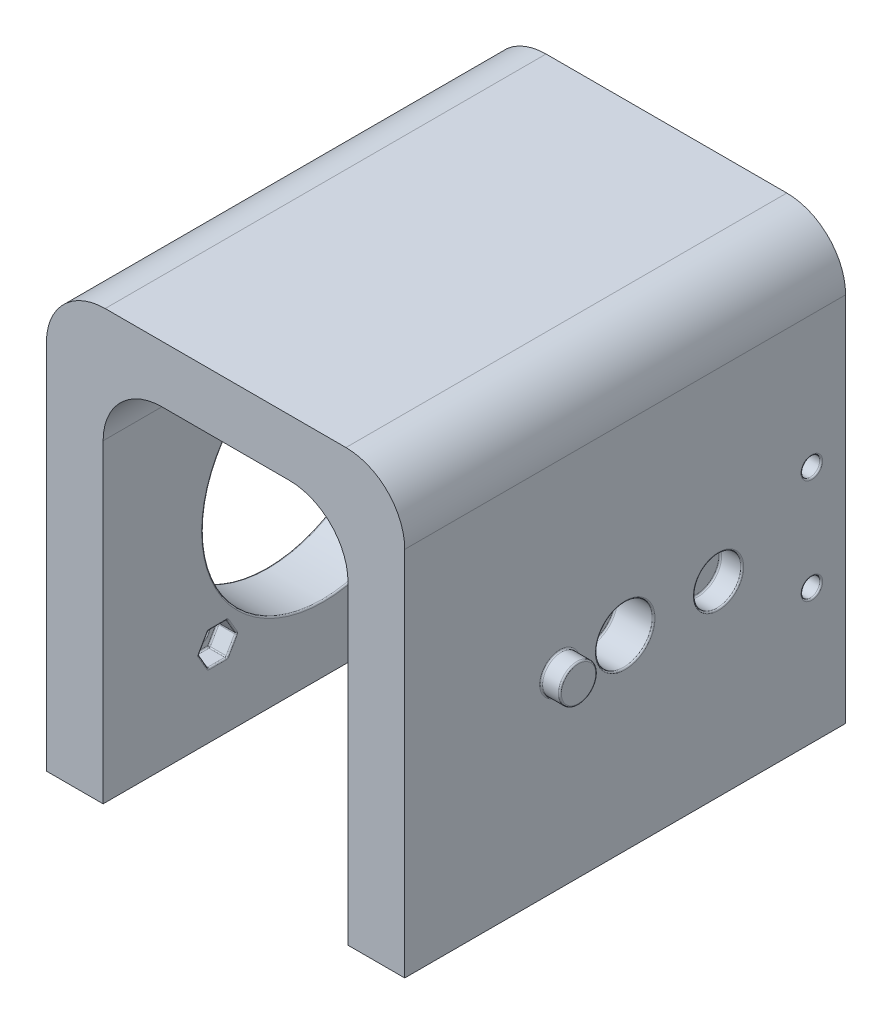
from build123d import *

# Parameters (mm, degrees)
BOSS_EXTRUDE1_DEPTH = 75
CUT_EXTRUDE1_REACH  = 123.212
SKETCH2_R           = 20.500000021
CUT_EXTRUDE2_REACH  = 123.212
SKETCH3_R           = 1.5875
CUT_EXTRUDE3_REACH  = 118.656
SKETCH4_R           = 3.429
BOSS_EXTRUDE2_START = 1.5875
SKETCH5_R           = 4.7625
SKETCH5_R_2         = 3.429
BOSS_EXTRUDE2_DEPTH = 1.5875
CUT_EXTRUDE5_REACH  = 123.212
SKETCH6_R           = 1.5875
SKETCH7_R           = 4.03225
CUT_EXTRUDE6_DEPTH  = 3.75
SKETCH8_R           = 4.826
CUT_EXTRUDE7_DEPTH  = 6.35
SKETCH9_R           = 3.175
BOSS_EXTRUDE3_DEPTH = 3.175
CUT_EXTRUDE8_DEPTH  = 3.175
BOSS_EXTRUDE4_START = 4.8
SKETCH11_R          = 2.55
SKETCH11_R_2        = 1.5875
BOSS_EXTRUDE4_DEPTH = 4.8
CUT_EXTRUDE9_DEPTH  = 3.175
FILLET1_R           = 10
FILLET2_R           = 0.25
FILLET3_R           = 0.25


with BuildPart() as part:
    # Sketch1 → Boss-Extrude1 (new body)
    with BuildSketch(Plane.XY):
        Polygon((-20.828, 63.5), (20.828, 63.5), (20.828, 0), (30.48, 0), (30.48, 73.152), (-30.48, 73.152), (-30.48, 0), (-20.828, 0), align=None)
    extrude(amount=BOSS_EXTRUDE1_DEPTH)

    # Sketch2 → Cut-Extrude1 (cut, up to next)
    with BuildSketch(Plane.ZY.offset(30.48), mode=Mode.PRIVATE) as cut_extrude1_sk1:
        with Locations(Location((37.5, 31.75, 0), (0, 0, 270))):
            Circle(SKETCH2_R)
    cut_extrude1_tool1 = extrude(cut_extrude1_sk1.sketch, amount=-CUT_EXTRUDE1_REACH, mode=Mode.PRIVATE) & part.part
    add(cut_extrude1_tool1.solids().sort_by_distance((-30.48, 31.75, 37.5))[0], mode=Mode.SUBTRACT)

    # Sketch3 → Cut-Extrude2 (cut, up to next)
    with BuildSketch(Plane.ZY.offset(30.48), mode=Mode.PRIVATE) as cut_extrude2_sk1:
        with Locations(Location((19.5, 49.75, 0), (0, 0, 270))):
            Circle(SKETCH3_R)
    cut_extrude2_tool1 = extrude(cut_extrude2_sk1.sketch, amount=-CUT_EXTRUDE2_REACH, mode=Mode.PRIVATE) & part.part
    # Sketch3 → Cut-Extrude2 (cut, up to next)
    with BuildSketch(Plane.ZY.offset(30.48), mode=Mode.PRIVATE) as cut_extrude2_sk2:
        with Locations(Location((55.5, 49.75, 0), (0, 0, 270))):
            Circle(SKETCH3_R)
    cut_extrude2_tool2 = extrude(cut_extrude2_sk2.sketch, amount=-CUT_EXTRUDE2_REACH, mode=Mode.PRIVATE) & part.part
    # Sketch3 → Cut-Extrude2 (cut, up to next)
    with BuildSketch(Plane.ZY.offset(30.48), mode=Mode.PRIVATE) as cut_extrude2_sk3:
        with Locations(Location((55.5, 13.75, 0), (0, 0, 270))):
            Circle(SKETCH3_R)
    cut_extrude2_tool3 = extrude(cut_extrude2_sk3.sketch, amount=-CUT_EXTRUDE2_REACH, mode=Mode.PRIVATE) & part.part
    # Sketch3 → Cut-Extrude2 (cut, up to next)
    with BuildSketch(Plane.ZY.offset(30.48), mode=Mode.PRIVATE) as cut_extrude2_sk4:
        with Locations(Location((19.5, 13.75, 0), (0, 0, 270))):
            Circle(SKETCH3_R)
    cut_extrude2_tool4 = extrude(cut_extrude2_sk4.sketch, amount=-CUT_EXTRUDE2_REACH, mode=Mode.PRIVATE) & part.part
    add(cut_extrude2_tool1.solids().sort_by_distance((-30.48, 49.75, 19.5))[0], mode=Mode.SUBTRACT)
    add(cut_extrude2_tool2.solids().sort_by_distance((-30.48, 49.75, 55.5))[0], mode=Mode.SUBTRACT)
    add(cut_extrude2_tool3.solids().sort_by_distance((-30.48, 13.75, 55.5))[0], mode=Mode.SUBTRACT)
    add(cut_extrude2_tool4.solids().sort_by_distance((-30.48, 13.75, 19.5))[0], mode=Mode.SUBTRACT)

    # Sketch4 → Cut-Extrude3 (cut, up to next)
    with BuildSketch(Plane.ZY.offset(-20.828), mode=Mode.PRIVATE) as cut_extrude3_sk1:
        with Locations((37.5, 31.75)):
            Circle(SKETCH4_R)
    cut_extrude3_tool1 = extrude(cut_extrude3_sk1.sketch, amount=-CUT_EXTRUDE3_REACH, mode=Mode.PRIVATE) & part.part
    add(cut_extrude3_tool1.solids().sort_by_distance((20.828, 31.75, 37.5))[0], mode=Mode.SUBTRACT)

    # Sketch5 → Boss-Extrude2 (add)
    with BuildSketch(Plane.ZY.offset(-20.828).offset(BOSS_EXTRUDE2_START)):
        with Locations(Location((37.5, 31.75, 0), (0, 0, 180))):
            Circle(SKETCH5_R)
        with Locations((37.5, 31.75)):
            Circle(SKETCH5_R_2, mode=Mode.SUBTRACT)
    extrude(amount=-BOSS_EXTRUDE2_DEPTH)

    # Sketch6 → Cut-Extrude5 (cut, up to next)
    with BuildSketch(Plane(origin=(30.48, 0, 0), x_dir=(0, 0, -1), z_dir=(1, 0, 0)), mode=Mode.PRIVATE) as cut_extrude5_sk1:
        with Locations(Location((-5.75, 40.64, 0), (0, 0, 90))):
            Circle(SKETCH6_R)
    cut_extrude5_tool1 = extrude(cut_extrude5_sk1.sketch, amount=-CUT_EXTRUDE5_REACH, mode=Mode.PRIVATE) & part.part
    # Sketch6 → Cut-Extrude5 (cut, up to next)
    with BuildSketch(Plane(origin=(30.48, 0, 0), x_dir=(0, 0, -1), z_dir=(1, 0, 0)), mode=Mode.PRIVATE) as cut_extrude5_sk2:
        with Locations(Location((-5.75, 22.86, 0), (0, 0, 90))):
            Circle(SKETCH6_R)
    cut_extrude5_tool2 = extrude(cut_extrude5_sk2.sketch, amount=-CUT_EXTRUDE5_REACH, mode=Mode.PRIVATE) & part.part
    add(cut_extrude5_tool1.solids().sort_by_distance((30.48, 40.64, 5.75))[0], mode=Mode.SUBTRACT)
    add(cut_extrude5_tool2.solids().sort_by_distance((30.48, 22.86, 5.75))[0], mode=Mode.SUBTRACT)

    # Sketch7 → Cut-Extrude6 (cut)
    with BuildSketch(Plane(origin=(30.48, 0, 0), x_dir=(0, 0, -1), z_dir=(1, 0, 0))):
        with Locations(Location((-21.625, 31.75, 0), (0, 0, 90))):
            Circle(SKETCH7_R)
    extrude(amount=-CUT_EXTRUDE6_DEPTH, mode=Mode.SUBTRACT)

    # Sketch8 → Cut-Extrude7 (cut)
    with BuildSketch(Plane(origin=(30.48, 0, 0), x_dir=(0, 0, -1), z_dir=(1, 0, 0))):
        with Locations(Location((-37.5, 31.75, 0), (0, 0, 90))):
            Circle(SKETCH8_R)
    extrude(amount=-CUT_EXTRUDE7_DEPTH, mode=Mode.SUBTRACT)

    # Sketch9 → Boss-Extrude3 (add)
    with BuildSketch(Plane(origin=(30.48, 0, 0), x_dir=(0, 0, -1), z_dir=(1, 0, 0))):
        with Locations(Location((-48.6125, 31.75, 0), (0, 0, 270))):
            Circle(SKETCH9_R)
    extrude(amount=BOSS_EXTRUDE3_DEPTH)

    # Sketch10 → Cut-Extrude8 (cut)
    with BuildSketch(Plane.ZY.offset(-20.828)):
        Polygon((8.925, 40.64), (7.3375, 43.389630657), (4.1625, 43.389630657), (2.575, 40.64), (4.1625, 37.890369343), (7.3375, 37.890369343), align=None)
        Polygon((8.925, 22.86), (7.3375, 25.609630657), (4.1625, 25.609630657), (2.575, 22.86), (4.1625, 20.110369343), (7.3375, 20.110369343), align=None)
    extrude(amount=-CUT_EXTRUDE8_DEPTH, mode=Mode.SUBTRACT)

    # Sketch11 → Boss-Extrude4 (add)
    # profile 1 of 4: a face of its own
    with BuildSketch(Plane.ZY.offset(30.48).offset(BOSS_EXTRUDE4_START)):
        with Locations(Location((19.5, 49.75, 0), (0, 0, 90))):
            Circle(SKETCH11_R)
        with Locations(Location((19.5, 49.75, 0), (0, 0, 270))):
            Circle(SKETCH11_R_2, mode=Mode.SUBTRACT)
    # profile 2 of 4: a face of its own
    with BuildSketch(Plane.ZY.offset(30.48).offset(BOSS_EXTRUDE4_START)):
        with Locations(Location((55.5, 49.75, 0), (0, 0, 90))):
            Circle(SKETCH11_R)
        with Locations(Location((55.5, 49.75, 0), (0, 0, 270))):
            Circle(SKETCH11_R_2, mode=Mode.SUBTRACT)
    # profile 3 of 4: a face of its own
    with BuildSketch(Plane.ZY.offset(30.48).offset(BOSS_EXTRUDE4_START)):
        with Locations(Location((55.5, 13.75, 0), (0, 0, 90))):
            Circle(SKETCH11_R)
        with Locations(Location((55.5, 13.75, 0), (0, 0, 270))):
            Circle(SKETCH11_R_2, mode=Mode.SUBTRACT)
    # profile 4 of 4: a face of its own
    with BuildSketch(Plane.ZY.offset(30.48).offset(BOSS_EXTRUDE4_START)):
        with Locations(Location((19.5, 13.75, 0), (0, 0, 90))):
            Circle(SKETCH11_R)
        with Locations(Location((19.5, 13.75, 0), (0, 0, 270))):
            Circle(SKETCH11_R_2, mode=Mode.SUBTRACT)
    extrude(amount=-BOSS_EXTRUDE4_DEPTH)

    # Sketch12 → Cut-Extrude9 (cut)
    with BuildSketch(Plane(origin=(-20.828, 0, 0), x_dir=(0, 0, -1), z_dir=(1, 0, 0))):
        Polygon((-16.325, 49.75), (-17.9125, 52.499630657), (-21.0875, 52.499630657), (-22.675, 49.75), (-21.0875, 47.000369343), (-17.9125, 47.000369343), align=None)
        Polygon((-16.325, 13.75), (-17.9125, 16.499630657), (-21.0875, 16.499630657), (-22.675, 13.75), (-21.0875, 11.000369343), (-17.9125, 11.000369343), align=None)
        Polygon((-52.325, 13.75), (-53.9125, 16.499630657), (-57.0875, 16.499630657), (-58.675, 13.75), (-57.0875, 11.000369343), (-53.9125, 11.000369343), align=None)
        Polygon((-52.325, 49.75), (-53.9125, 52.499630657), (-57.0875, 52.499630657), (-58.675, 49.75), (-57.0875, 47.000369343), (-53.9125, 47.000369343), align=None)
    extrude(amount=-CUT_EXTRUDE9_DEPTH, mode=Mode.SUBTRACT)

    # Fillet1
    fillet1_edges = [part.edges().sort_by_distance(p)[0] for p in [
        (-30.48, 73.152, 37.5),
        (30.48, 73.152, 37.5),
        (20.828, 63.5, 37.5),
        (-20.828, 63.5, 37.5),
    ]]
    fillet(fillet1_edges, radius=FILLET1_R)

    # Fillet2
    fillet2_edges = [part.edges().sort_by_distance(p)[0] for p in [
        (24.003, 21.2725, 5.75),
        (-30.48, 47.2, 19.5),
        (-35.28, 47.2, 19.5),
        (-35.28, 51.3375, 19.5),
        (-30.48, 47.2, 55.5),
        (-35.28, 47.2, 55.5),
        (-35.28, 51.3375, 55.5),
        (-30.48, 11.2, 55.5),
        (-35.28, 11.2, 55.5),
        (-35.28, 15.3375, 55.5),
        (-30.48, 11.2, 19.5),
        (-35.28, 11.2, 19.5),
        (-35.28, 15.3375, 19.5),
        (-30.48, 52.250000021, 37.5),
        (-20.828, 52.250000021, 37.5),
        (20.828, 31.75, 42.2625),
        (19.2405, 31.75, 42.2625),
        (19.2405, 31.75, 34.071),
        (30.48, 39.0525, 5.75),
        (30.48, 21.2725, 5.75),
        (26.73, 27.71775, 21.625),
        (30.48, 27.71775, 21.625),
        (30.48, 26.924, 37.5),
        (24.13, 26.924, 37.5),
        (30.48, 34.925, 48.6125),
        (33.655, 34.925, 48.6125),
        (24.003, 39.0525, 5.75),
    ]]
    fillet(fillet2_edges, radius=FILLET2_R)

    # Fillet3
    fillet3_edges = [part.edges().sort_by_distance(p)[0] for p in [
        (20.828, 21.485184671, 8.13125),
        (20.828, 24.234815329, 8.13125),
        (20.828, 25.609630657, 5.75),
        (20.828, 24.234815329, 3.36875),
        (20.828, 21.485184671, 3.36875),
        (20.828, 20.110369343, 5.75),
        (24.003, 21.485184671, 8.13125),
        (22.4155, 22.86, 8.925),
        (24.003, 20.110369343, 5.75),
        (22.4155, 20.110369343, 7.3375),
        (24.003, 21.485184671, 3.36875),
        (22.4155, 20.110369343, 4.1625),
        (24.003, 24.234815329, 3.36875),
        (22.4155, 22.86, 2.575),
        (24.003, 25.609630657, 5.75),
        (22.4155, 25.609630657, 4.1625),
        (24.003, 24.234815329, 8.13125),
        (22.4155, 25.609630657, 7.3375),
        (-20.828, 48.375184671, 53.11875),
        (-20.828, 51.124815329, 53.11875),
        (-20.828, 52.499630657, 55.5),
        (-20.828, 51.124815329, 57.88125),
        (-20.828, 48.375184671, 57.88125),
        (-20.828, 47.000369343, 55.5),
        (-24.003, 48.375184671, 53.11875),
        (-22.4155, 49.75, 52.325),
        (-24.003, 47.000369343, 55.5),
        (-22.4155, 47.000369343, 53.9125),
        (-24.003, 48.375184671, 57.88125),
        (-22.4155, 47.000369343, 57.0875),
        (-24.003, 51.124815329, 57.88125),
        (-22.4155, 49.75, 58.675),
        (-24.003, 52.499630657, 55.5),
        (-22.4155, 52.499630657, 57.0875),
        (-24.003, 51.124815329, 53.11875),
        (-22.4155, 52.499630657, 53.9125),
        (-24.003, 51.3375, 55.5),
        (-20.828, 12.375184671, 53.11875),
        (-20.828, 15.124815329, 53.11875),
        (-20.828, 16.499630657, 55.5),
        (-20.828, 15.124815329, 57.88125),
        (-20.828, 12.375184671, 57.88125),
        (-20.828, 11.000369343, 55.5),
        (-24.003, 12.375184671, 53.11875),
        (-22.4155, 13.75, 52.325),
        (-24.003, 11.000369343, 55.5),
        (-22.4155, 11.000369343, 53.9125),
        (-24.003, 12.375184671, 57.88125),
        (-22.4155, 11.000369343, 57.0875),
        (-24.003, 15.124815329, 57.88125),
        (-22.4155, 13.75, 58.675),
        (-24.003, 16.499630657, 55.5),
        (-22.4155, 16.499630657, 57.0875),
        (-24.003, 15.124815329, 53.11875),
        (-22.4155, 16.499630657, 53.9125),
        (-24.003, 15.3375, 55.5),
        (-20.828, 12.375184671, 17.11875),
        (-20.828, 15.124815329, 17.11875),
        (-20.828, 16.499630657, 19.5),
        (-20.828, 15.124815329, 21.88125),
        (-20.828, 12.375184671, 21.88125),
        (-20.828, 11.000369343, 19.5),
        (-24.003, 12.375184671, 17.11875),
        (-22.4155, 13.75, 16.325),
        (-24.003, 11.000369343, 19.5),
        (-22.4155, 11.000369343, 17.9125),
        (-24.003, 12.375184671, 21.88125),
        (-22.4155, 11.000369343, 21.0875),
        (-24.003, 15.124815329, 21.88125),
        (-22.4155, 13.75, 22.675),
        (-24.003, 16.499630657, 19.5),
        (-22.4155, 16.499630657, 21.0875),
        (-24.003, 15.124815329, 17.11875),
        (-22.4155, 16.499630657, 17.9125),
        (-24.003, 15.3375, 19.5),
        (-20.828, 48.375184671, 17.11875),
        (-20.828, 51.124815329, 17.11875),
        (-20.828, 52.499630657, 19.5),
        (-20.828, 51.124815329, 21.88125),
        (-20.828, 48.375184671, 21.88125),
        (-20.828, 47.000369343, 19.5),
        (-24.003, 48.375184671, 17.11875),
        (-22.4155, 49.75, 16.325),
        (-24.003, 47.000369343, 19.5),
        (-22.4155, 47.000369343, 17.9125),
        (-24.003, 48.375184671, 21.88125),
        (-22.4155, 47.000369343, 21.0875),
        (-24.003, 51.124815329, 21.88125),
        (-22.4155, 49.75, 22.675),
        (-24.003, 52.499630657, 19.5),
        (-22.4155, 52.499630657, 21.0875),
        (-24.003, 51.124815329, 17.11875),
        (-22.4155, 52.499630657, 17.9125),
        (-24.003, 51.3375, 19.5),
        (20.828, 39.265184671, 8.13125),
        (20.828, 42.014815329, 8.13125),
        (20.828, 43.389630657, 5.75),
        (20.828, 42.014815329, 3.36875),
        (20.828, 39.265184671, 3.36875),
        (20.828, 37.890369343, 5.75),
        (24.003, 39.265184671, 8.13125),
        (22.4155, 40.64, 8.925),
        (24.003, 37.890369343, 5.75),
        (22.4155, 37.890369343, 7.3375),
        (24.003, 39.265184671, 3.36875),
        (22.4155, 37.890369343, 4.1625),
        (24.003, 42.014815329, 3.36875),
        (22.4155, 40.64, 2.575),
        (24.003, 43.389630657, 5.75),
        (22.4155, 43.389630657, 4.1625),
        (24.003, 42.014815329, 8.13125),
        (22.4155, 43.389630657, 7.3375),
    ]]
    fillet(fillet3_edges, radius=FILLET3_R)


solid = part.part
